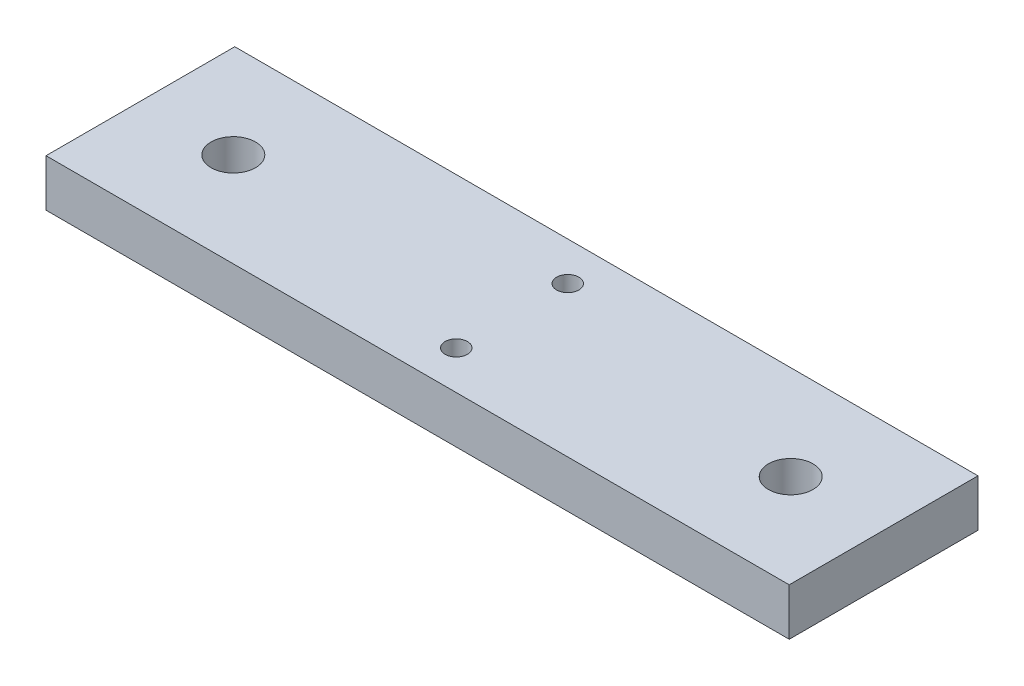
from build123d import *

# Parameters (mm, degrees)
CROQUIS1_W              = 200
CROQUIS1_H              = 50.8
CROQUIS1_R              = 3
CROQUIS1_R_2            = 6
SALIENTE_EXTRUIR1_DEPTH = 12.7


with BuildPart() as part:
    # Croquis1 → Saliente-Extruir1 (new body)
    with BuildSketch(Plane(origin=(0, 0, 0), x_dir=(1, 0, 0), z_dir=(0, 1, 0))):
        Rectangle(CROQUIS1_W, CROQUIS1_H)
        with Locations(Location((0, 15, 0), (0, 0, 270))):
            Circle(CROQUIS1_R, mode=Mode.SUBTRACT)
        with Locations(Location((0, -15, 0), (0, 0, 270))):
            Circle(CROQUIS1_R, mode=Mode.SUBTRACT)
        with Locations(Location((-75, 0, 0), (0, 0, 270))):
            Circle(CROQUIS1_R_2, mode=Mode.SUBTRACT)
        with Locations(Location((75, 0, 0), (0, 0, 270))):
            Circle(CROQUIS1_R_2, mode=Mode.SUBTRACT)
    extrude(amount=SALIENTE_EXTRUIR1_DEPTH)


solid = part.part
